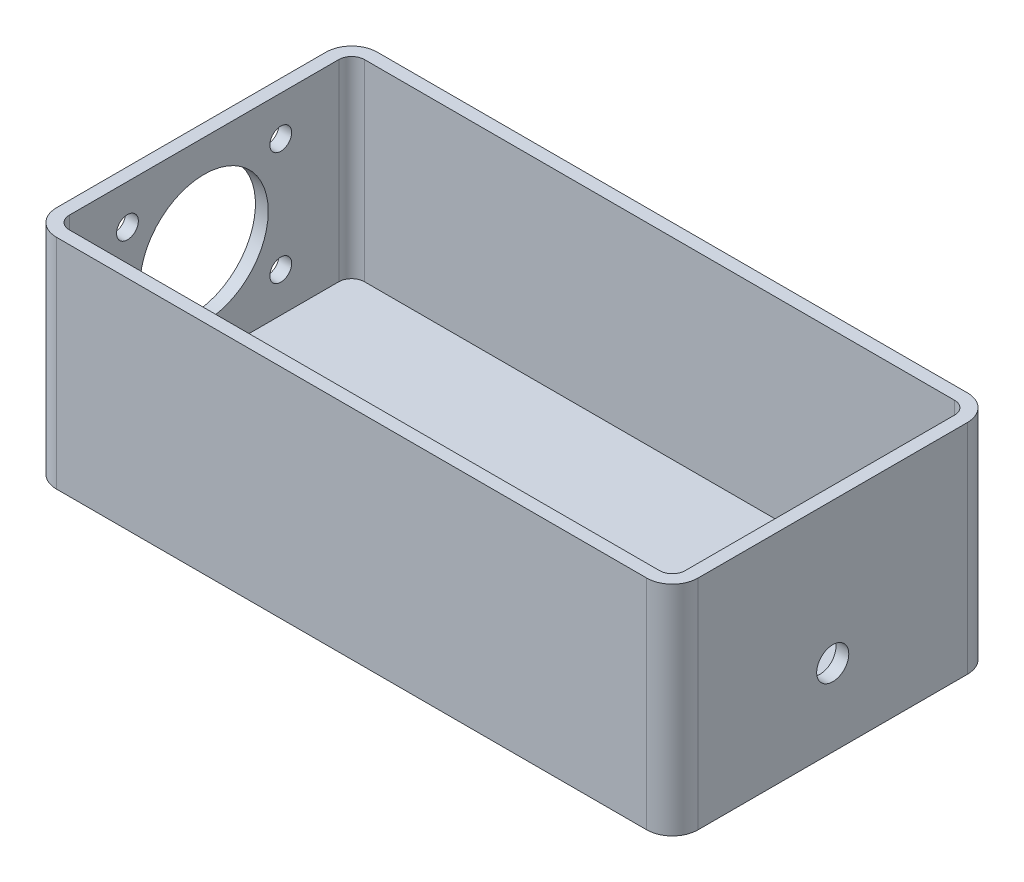
from build123d import *

# Parameters (mm, degrees)
SKETCH1_W           = 127
SKETCH1_H           = 63.5
BOSS_EXTRUDE1_DEPTH = 5.08
SKETCH2_W           = 127
SKETCH2_H           = 63.5
SKETCH2_W_2         = 121.92
SKETCH2_H_2         = 58.42
BOSS_EXTRUDE3_DEPTH = 38.1
CUT_EXTRUDE1_REACH  = 150.411
SKETCH3_R           = 12.7
SKETCH3_R_2         = 2.159
CUT_EXTRUDE3_REACH  = 150.411
SKETCH4_R           = 3.175
FILLET3_R           = 5.08
FILLET4_R           = 2.54


with BuildPart() as part:
    # Sketch1 → Boss-Extrude1 (new body)
    with BuildSketch(Plane(origin=(0, 0, 0), x_dir=(1, 0, 0), z_dir=(0, 1, 0))):
        with Locations((63.5, 31.75)):
            Rectangle(SKETCH1_W, SKETCH1_H)
    extrude(amount=BOSS_EXTRUDE1_DEPTH)

    # Sketch2 → Boss-Extrude3 (add)
    with BuildSketch(Plane(origin=(0, 5.08, 0), x_dir=(1, 0, 0), z_dir=(0, 1, 0))):
        with Locations((63.5, 31.75)):
            Rectangle(SKETCH2_W, SKETCH2_H)
        with Locations((63.5, 31.75)):
            Rectangle(SKETCH2_W_2, SKETCH2_H_2, mode=Mode.SUBTRACT)
    extrude(amount=BOSS_EXTRUDE3_DEPTH)

    # Sketch3 → Cut-Extrude1 (cut, up to next)
    with BuildSketch(Plane.ZY, mode=Mode.PRIVATE) as cut_extrude1_sk1:
        with Locations((-31.75, 24.13)):
            Circle(SKETCH3_R)
    cut_extrude1_tool1 = extrude(cut_extrude1_sk1.sketch, amount=-CUT_EXTRUDE1_REACH, mode=Mode.PRIVATE) & part.part
    # Sketch3 → Cut-Extrude1 (cut, up to next)
    with BuildSketch(Plane.ZY, mode=Mode.PRIVATE) as cut_extrude1_sk2:
        with Locations((-46.9265, 35.3568)):
            Circle(SKETCH3_R_2)
    cut_extrude1_tool2 = extrude(cut_extrude1_sk2.sketch, amount=-CUT_EXTRUDE1_REACH, mode=Mode.PRIVATE) & part.part
    # Sketch3 → Cut-Extrude1 (cut, up to next)
    with BuildSketch(Plane.ZY, mode=Mode.PRIVATE) as cut_extrude1_sk3:
        with Locations((-16.5735, 35.3568)):
            Circle(SKETCH3_R_2)
    cut_extrude1_tool3 = extrude(cut_extrude1_sk3.sketch, amount=-CUT_EXTRUDE1_REACH, mode=Mode.PRIVATE) & part.part
    # Sketch3 → Cut-Extrude1 (cut, up to next)
    with BuildSketch(Plane.ZY, mode=Mode.PRIVATE) as cut_extrude1_sk4:
        with Locations((-46.9265, 12.9032)):
            Circle(SKETCH3_R_2)
    cut_extrude1_tool4 = extrude(cut_extrude1_sk4.sketch, amount=-CUT_EXTRUDE1_REACH, mode=Mode.PRIVATE) & part.part
    # Sketch3 → Cut-Extrude1 (cut, up to next)
    with BuildSketch(Plane.ZY, mode=Mode.PRIVATE) as cut_extrude1_sk5:
        with Locations((-16.5735, 12.9032)):
            Circle(SKETCH3_R_2)
    cut_extrude1_tool5 = extrude(cut_extrude1_sk5.sketch, amount=-CUT_EXTRUDE1_REACH, mode=Mode.PRIVATE) & part.part
    add(cut_extrude1_tool1.solids().sort_by_distance((0, 24.13, -31.75))[0], mode=Mode.SUBTRACT)
    add(cut_extrude1_tool2.solids().sort_by_distance((0, 35.3568, -46.9265))[0], mode=Mode.SUBTRACT)
    add(cut_extrude1_tool3.solids().sort_by_distance((0, 35.3568, -16.5735))[0], mode=Mode.SUBTRACT)
    add(cut_extrude1_tool4.solids().sort_by_distance((0, 12.9032, -46.9265))[0], mode=Mode.SUBTRACT)
    add(cut_extrude1_tool5.solids().sort_by_distance((0, 12.9032, -16.5735))[0], mode=Mode.SUBTRACT)

    # Sketch4 → Cut-Extrude3 (cut, up to next)
    with BuildSketch(Plane(origin=(127, 0, 0), x_dir=(0, 0, -1), z_dir=(1, 0, 0)), mode=Mode.PRIVATE) as cut_extrude3_sk1:
        with Locations((31.75, 15.24)):
            Circle(SKETCH4_R)
    cut_extrude3_tool1 = extrude(cut_extrude3_sk1.sketch, amount=-CUT_EXTRUDE3_REACH, mode=Mode.PRIVATE) & part.part
    add(cut_extrude3_tool1.solids().sort_by_distance((127, 15.24, -31.75))[0], mode=Mode.SUBTRACT)

    # Fillet3
    fillet3_edges = [part.edges().sort_by_distance(p)[0] for p in [
        (0, 21.59, -63.5),
        (127, 21.59, -63.5),
        (127, 21.59, 0),
        (0, 21.59, 0),
    ]]
    fillet(fillet3_edges, radius=FILLET3_R)

    # Fillet4
    fillet4_edges = [part.edges().sort_by_distance(p)[0] for p in [
        (2.54, 24.13, -2.54),
        (124.46, 24.13, -2.54),
        (124.46, 24.13, -60.96),
        (2.54, 24.13, -60.96),
    ]]
    fillet(fillet4_edges, radius=FILLET4_R)


solid = part.part
